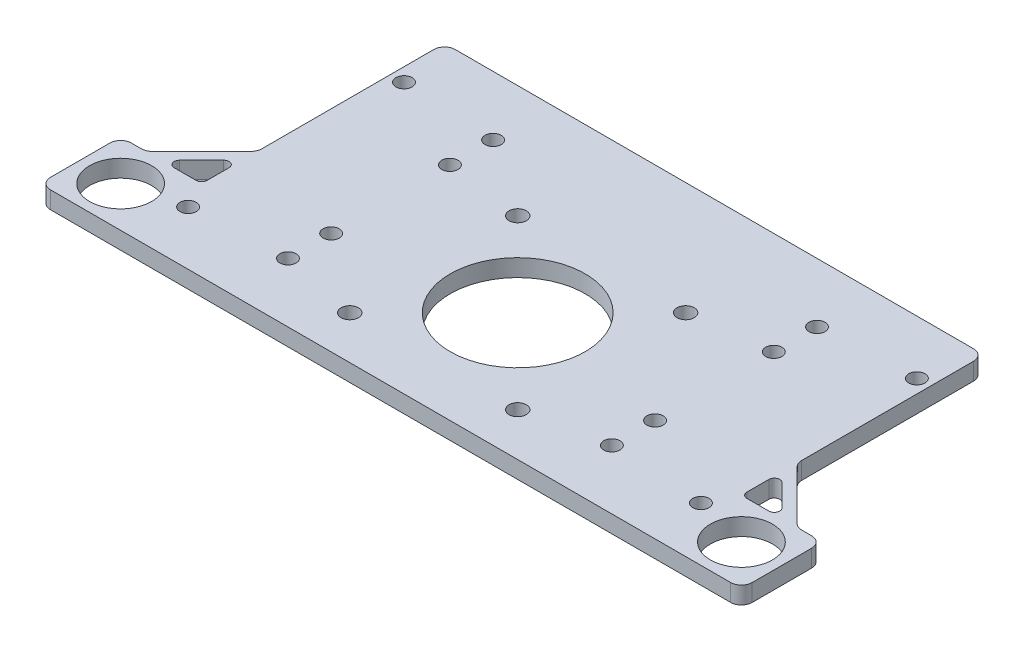
from build123d import *

# Parameters (mm, degrees)
SKETCH_1_W          = 100
SKETCH_1_H          = 60
EXTRUDE_1_DEPTH     = 3.2
SKETCH_2_R          = 12.5
SKETCH_2_R_2        = 1.6
SKETCH_2_R_3        = 1.5
SKETCH_2_R_4        = 5.75
CUT_EXTRUDE_1_DEPTH = 3.2
FILLET_1_R          = 2
FILLET_2_R          = 1


with BuildPart() as part:
    # 草图1 → 凸台-拉伸1 (new body)
    with BuildSketch(Plane(origin=(0, 0, 0), x_dir=(1, 0, 0), z_dir=(0, 1, 0))):
        Polygon((-57.5, -15), (-60.328427125, -15), (-65, -15), (-65, -30), (-50, -30), (-50, -15), align=None)
        Rectangle(SKETCH_1_W, SKETCH_1_H)
        Polygon((-50, -7.5), (-50, -4.671572875), (-60.328427125, -15), (-57.5, -15), align=None)
        Polygon((65, -15), (60.328427125, -15), (57.5, -15), (50, -15), (50, -30), (65, -30), align=None)
        Polygon((60.328427125, -15), (50, -4.671572875), (50, -7.5), (57.5, -15), align=None)
    extrude(amount=EXTRUDE_1_DEPTH)

    # 草图2 → 切除-拉伸1 (cut)
    with BuildSketch(Plane(origin=(0, 3.2, 0), x_dir=(1, 0, 0), z_dir=(0, 1, 0))):
        with Locations(Location((0, -6.443650814, 0), (0, 0, 270))):
            Circle(SKETCH_2_R)
        with Locations(Location((15.556349186, -22, 0), (0, 0, 270))):
            Circle(SKETCH_2_R_2)
        with Locations(Location((15.556349186, 9.112698372, 0), (0, 0, 270))):
            Circle(SKETCH_2_R_2)
        with Locations(Location((-15.556349186, 9.112698372, 0), (0, 0, 270))):
            Circle(SKETCH_2_R_2)
        with Locations(Location((-15.556349186, -22, 0), (0, 0, 270))):
            Circle(SKETCH_2_R_2)
        with Locations(Location((-47.5, 20, 0), (0, 0, 270))):
            Circle(SKETCH_2_R_3)
        with Locations(Location((-47.5, -20, 0), (0, 0, 270))):
            Circle(SKETCH_2_R_3)
        with Locations(Location((47.5, -20, 0), (0, 0, 270))):
            Circle(SKETCH_2_R_3)
        with Locations(Location((47.5, 20, 0), (0, 0, 270))):
            Circle(SKETCH_2_R_3)
        with Locations(Location((-57.5, -22.5, 0), (0, 0, 270))):
            Circle(SKETCH_2_R_4)
        with Locations(Location((57.5, -22.5, 0), (0, 0, 270))):
            Circle(SKETCH_2_R_4)
        with Locations(Location((30, 19, 0), (0, 0, 270))):
            Circle(SKETCH_2_R_3)
        with Locations(Location((30, 11, 0), (0, 0, 270))):
            Circle(SKETCH_2_R_3)
        with Locations(Location((-30, 11, 0), (0, 0, 270))):
            Circle(SKETCH_2_R_3)
        with Locations(Location((-30, 19, 0), (0, 0, 270))):
            Circle(SKETCH_2_R_3)
        with Locations(Location((30, -11, 0), (0, 0, 270))):
            Circle(SKETCH_2_R_3)
        with Locations(Location((30, -19, 0), (0, 0, 270))):
            Circle(SKETCH_2_R_3)
        with Locations(Location((-30, -19, 0), (0, 0, 270))):
            Circle(SKETCH_2_R_3)
        with Locations(Location((-30, -11, 0), (0, 0, 270))):
            Circle(SKETCH_2_R_3)
    extrude(amount=-CUT_EXTRUDE_1_DEPTH, mode=Mode.SUBTRACT)

    # 圆角1
    fillet_1_edges = [part.edges().sort_by_distance(p)[0] for p in [
        (-60.328427125, 1.6, 15),
        (-50, 1.6, 4.671572875),
        (-50, 1.6, -30),
        (50, 1.6, -30),
        (50, 1.6, 4.671572875),
        (60.328427125, 1.6, 15),
        (65, 1.6, 15),
        (65, 1.6, 30),
        (-65, 1.6, 30),
        (-65, 1.6, 15),
    ]]
    fillet(fillet_1_edges, radius=FILLET_1_R)

    # 圆角2
    fillet_2_edges = [part.edges().sort_by_distance(p)[0] for p in [
        (-57.5, 1.6, 15),
        (-50, 1.6, 15),
        (-50, 1.6, 7.5),
        (50, 1.6, 7.5),
        (50, 1.6, 15),
        (57.5, 1.6, 15),
    ]]
    fillet(fillet_2_edges, radius=FILLET_2_R)


solid = part.part
